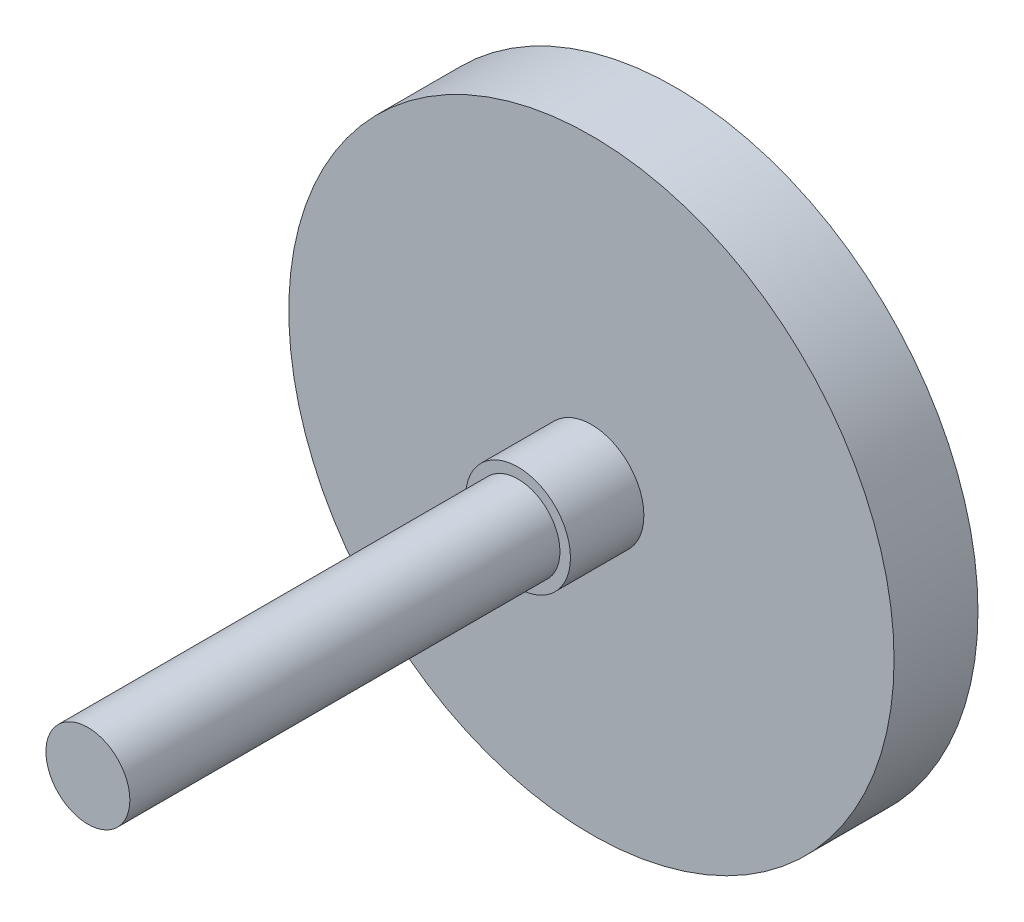
from build123d import *

# Parameters (mm, degrees)
ESQUISSE1_R             = 28.85
BOSS_EXTRU_1_DEPTH      = 8
ESQUISSE3_R             = 4
ENL_V_MAT_EXTRU_1_DEPTH = 2
ESQUISSE2_R             = 5
ESQUISSE2_R_2           = 4
BOSS_EXTRU_2_DEPTH      = 7
ESQUISSE2_2_R           = 5
ESQUISSE2_2_R_2         = 4
BOSS_EXTRU_3_DEPTH      = 2
ESQUISSE2_3_R           = 5
ESQUISSE2_3_R_2         = 4
BOSS_EXTRU_4_DEPTH      = 4
ESQUISSE4_R             = 4
BOSS_EXTRU_6_DEPTH      = 48


with BuildPart() as part:
    # Esquisse1 → Boss.-Extru.1 (new body)
    with BuildSketch(Plane.XY):
        Circle(ESQUISSE1_R)
    extrude(amount=BOSS_EXTRU_1_DEPTH)

    # Esquisse3 → Enlèv. mat.-Extru.1 (cut)
    with BuildSketch(Plane(origin=(0, 0, 0), x_dir=(-1, 0, 0), z_dir=(0, 0, -1))):
        Circle(ESQUISSE3_R)
    extrude(amount=-ENL_V_MAT_EXTRU_1_DEPTH, mode=Mode.SUBTRACT)

    # Esquisse2 → Boss.-Extru.2 (add)
    with BuildSketch(Plane.XY.offset(8)):
        Circle(ESQUISSE2_R)
        Circle(ESQUISSE2_R_2, mode=Mode.SUBTRACT)
    extrude(amount=BOSS_EXTRU_2_DEPTH)

    # Esquisse2<2> → Boss.-Extru.3 (add)
    with BuildSketch(Plane.XY.offset(8)):
        Circle(ESQUISSE2_2_R)
        Circle(ESQUISSE2_2_R_2, mode=Mode.SUBTRACT)
    extrude(amount=BOSS_EXTRU_3_DEPTH)

    # Esquisse2<3> → Boss.-Extru.4 (add)
    with BuildSketch(Plane.XY.offset(8)):
        Circle(ESQUISSE2_3_R)
        Circle(ESQUISSE2_3_R_2, mode=Mode.SUBTRACT)
    extrude(amount=BOSS_EXTRU_4_DEPTH)

    # Esquisse4 → Boss.-Extru.6 (add)
    with BuildSketch(Plane.XY.offset(8)):
        Circle(ESQUISSE4_R)
    extrude(amount=BOSS_EXTRU_6_DEPTH)


solid = part.part
